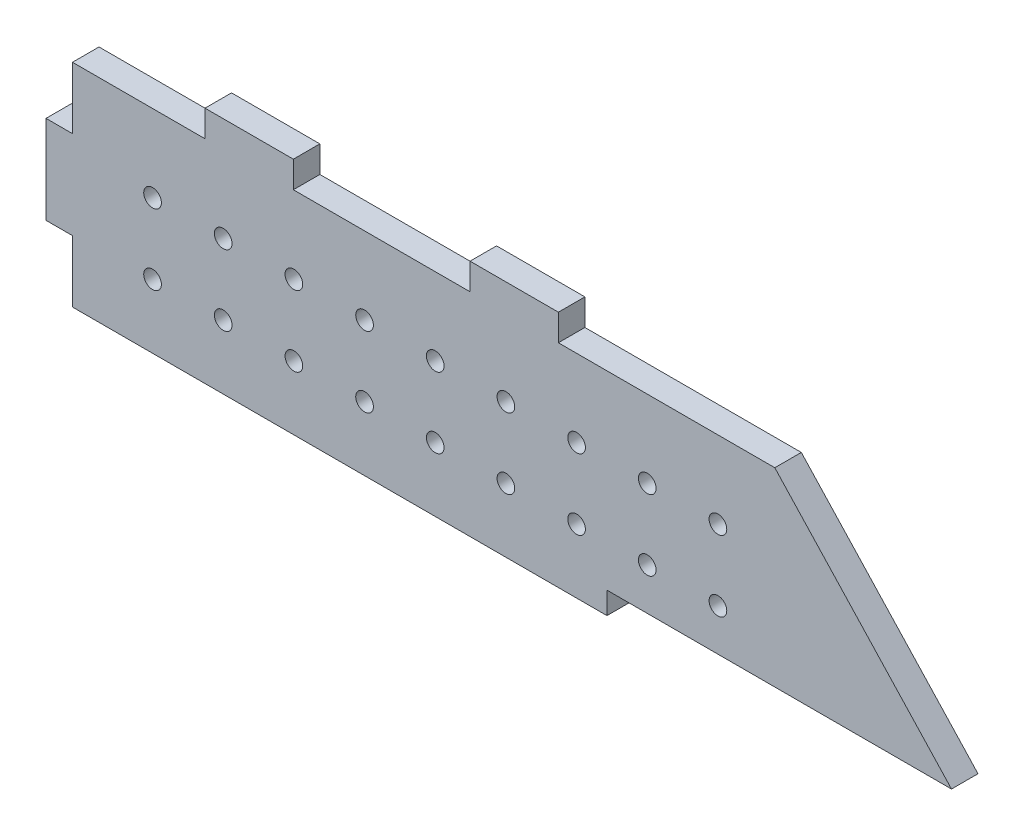
from build123d import *

# Parameters (mm, degrees)
ESQUISSE1_W             = 199
ESQUISSE1_H             = 48
BOSS_EXTRU_1_DEPTH      = 6
ESQUISSE2_W             = 20
ESQUISSE2_H             = 6
BOSS_EXTRU_2_DEPTH      = 6
ESQUISSE3_W             = 6
ESQUISSE3_H             = 20
BOSS_EXTRU_3_DEPTH      = 6
ESQUISSE4_W             = 78
ESQUISSE4_H             = 5
ENL_V_MAT_EXTRU_1_DEPTH = 213.077815907
ENL_V_MAT_EXTRU_2_DEPTH = 213.077815907
ESQUISSE6_R             = 1.005
ENL_V_MAT_EXTRU_3_DEPTH = 213.077815907
ESQUISSE7_R             = 2
ENL_V_MAT_EXTRU_4_DEPTH = 3


with BuildPart() as part:
    # Esquisse1 → Boss.-Extru.1 (new body)
    with BuildSketch(Plane.XY):
        with Locations((-99.5, 24)):
            Rectangle(ESQUISSE1_W, ESQUISSE1_H)
    extrude(amount=BOSS_EXTRU_1_DEPTH)

    # Esquisse2 → Boss.-Extru.2 (add)
    with BuildSketch(Plane(origin=(0, 48, 0), x_dir=(1, 0, 0), z_dir=(0, 1, 0))):
        with Locations((-99, -3)):
            Rectangle(ESQUISSE2_W, ESQUISSE2_H)
        with Locations((-159, -3)):
            Rectangle(ESQUISSE2_W, ESQUISSE2_H)
    extrude(amount=BOSS_EXTRU_2_DEPTH)

    # Esquisse3 → Boss.-Extru.3 (add)
    with BuildSketch(Plane.ZY.offset(199)):
        with Locations((3, 24)):
            Rectangle(ESQUISSE3_W, ESQUISSE3_H)
    extrude(amount=BOSS_EXTRU_3_DEPTH)

    # Esquisse4 → Enlèv. mat.-Extru.1 (cut, through all)
    with BuildSketch(Plane.XY.offset(6)):
        with Locations((-39, 2.5)):
            Rectangle(ESQUISSE4_W, ESQUISSE4_H)
    extrude(amount=-ENL_V_MAT_EXTRU_1_DEPTH, mode=Mode.SUBTRACT)

    # Esquisse5 → Enlèv. mat.-Extru.2 (cut, through all)
    with BuildSketch(Plane.XY.offset(6)):
        Polygon((0, 48), (-40, 48), (0, 5), align=None)
    extrude(amount=-ENL_V_MAT_EXTRU_2_DEPTH, mode=Mode.SUBTRACT)

    # Esquisse6 → Enlèv. mat.-Extru.3 (cut, through all)
    with BuildSketch(Plane.XY.offset(6)):
        with Locations((-148.88, 14.5)):
            Circle(ESQUISSE6_R)
        with Locations((-148.88, 30.5)):
            Circle(ESQUISSE6_R)
        with Locations((-132.88, 14.5)):
            Circle(ESQUISSE6_R)
        with Locations((-132.88, 30.5)):
            Circle(ESQUISSE6_R)
        with Locations((-116.88, 14.5)):
            Circle(ESQUISSE6_R)
        with Locations((-116.88, 30.5)):
            Circle(ESQUISSE6_R)
        with Locations((-100.88, 14.5)):
            Circle(ESQUISSE6_R)
        with Locations((-100.88, 30.5)):
            Circle(ESQUISSE6_R)
        with Locations((-84.88, 14.5)):
            Circle(ESQUISSE6_R)
        with Locations((-84.88, 30.5)):
            Circle(ESQUISSE6_R)
        with Locations((-68.88, 14.5)):
            Circle(ESQUISSE6_R)
        with Locations((-68.88, 30.5)):
            Circle(ESQUISSE6_R)
        with Locations((-52.88, 14.5)):
            Circle(ESQUISSE6_R)
        with Locations((-52.88, 30.5)):
            Circle(ESQUISSE6_R)
        with Locations((-164.88, 14.5)):
            Circle(ESQUISSE6_R)
        with Locations((-164.88, 30.5)):
            Circle(ESQUISSE6_R)
        with Locations((-180.88, 14.5)):
            Circle(ESQUISSE6_R)
        with Locations((-180.88, 30.5)):
            Circle(ESQUISSE6_R)
    extrude(amount=-ENL_V_MAT_EXTRU_3_DEPTH, mode=Mode.SUBTRACT)

    # Esquisse7 → Enlèv. mat.-Extru.4 (cut)
    with BuildSketch(Plane.XY.offset(6)):
        with Locations((-52.88, 14.5)):
            Circle(ESQUISSE7_R)
        with Locations((-52.88, 30.5)):
            Circle(ESQUISSE7_R)
        with Locations((-68.88, 14.5)):
            Circle(ESQUISSE7_R)
        with Locations((-68.88, 30.5)):
            Circle(ESQUISSE7_R)
        with Locations((-84.88, 14.5)):
            Circle(ESQUISSE7_R)
        with Locations((-84.88, 30.5)):
            Circle(ESQUISSE7_R)
        with Locations((-100.88, 14.5)):
            Circle(ESQUISSE7_R)
        with Locations((-100.88, 30.5)):
            Circle(ESQUISSE7_R)
        with Locations((-116.88, 14.5)):
            Circle(ESQUISSE7_R)
        with Locations((-116.88, 30.5)):
            Circle(ESQUISSE7_R)
        with Locations((-132.88, 14.5)):
            Circle(ESQUISSE7_R)
        with Locations((-132.88, 30.5)):
            Circle(ESQUISSE7_R)
        with Locations((-148.88, 14.5)):
            Circle(ESQUISSE7_R)
        with Locations((-148.88, 30.5)):
            Circle(ESQUISSE7_R)
        with Locations((-164.88, 14.5)):
            Circle(ESQUISSE7_R)
        with Locations((-164.88, 30.5)):
            Circle(ESQUISSE7_R)
        with Locations((-180.88, 14.5)):
            Circle(ESQUISSE7_R)
        with Locations((-180.88, 30.5)):
            Circle(ESQUISSE7_R)
    extrude(amount=-ENL_V_MAT_EXTRU_4_DEPTH, mode=Mode.SUBTRACT)


solid = part.part
